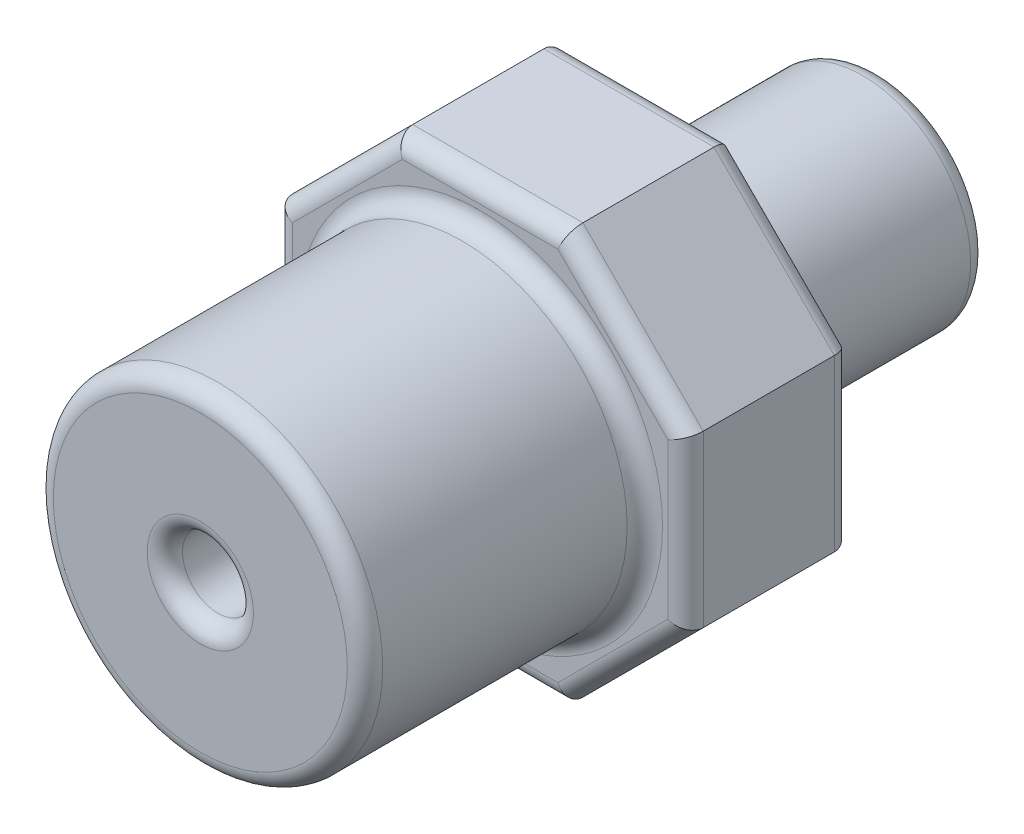
from build123d import *

# Parameters (mm, degrees)
SKETCH1_R           = 3.05
SKETCH1_R_2         = 1
BOSS_EXTRUDE1_DEPTH = 6.6
SKETCH2_R           = 1
BOSS_EXTRUDE2_DEPTH = 4.7
SKETCH3_R           = 4.65
SKETCH3_R_2         = 1
BOSS_EXTRUDE3_DEPTH = 7.9
FILLET1_R           = 0.5


with BuildPart() as part:
    # Sketch1 → Boss-Extrude1 (new body)
    with BuildSketch(Plane.XY):
        Circle(SKETCH1_R)
        Circle(SKETCH1_R_2, mode=Mode.SUBTRACT)
    extrude(amount=BOSS_EXTRUDE1_DEPTH)

    # Sketch2 → Boss-Extrude2 (add)
    with BuildSketch(Plane.XY.offset(6.6)):
        Polygon((5.8, -2.402438662), (5.8, 2.402438662), (2.402438662, 5.8), (-2.402438662, 5.8), (-5.8, 2.402438662), (-5.8, -2.402438662), (-2.402438662, -5.8), (2.402438662, -5.8), align=None)
        Circle(SKETCH2_R, mode=Mode.SUBTRACT)
    extrude(amount=BOSS_EXTRUDE2_DEPTH)

    # Sketch3 → Boss-Extrude3 (add)
    with BuildSketch(Plane.XY.offset(11.3)):
        Circle(SKETCH3_R)
        Circle(SKETCH3_R_2, mode=Mode.SUBTRACT)
    extrude(amount=BOSS_EXTRUDE3_DEPTH)

    # Fillet1
    fillet1_edges = [part.edges().sort_by_distance(p)[0] for p in [
        (-4.101219331, 4.101219331, 11.3),
        (-5.8, 0, 11.3),
        (-4.101219331, -4.101219331, 11.3),
        (0, -5.8, 11.3),
        (4.101219331, -4.101219331, 11.3),
        (5.8, 0, 11.3),
        (4.101219331, 4.101219331, 11.3),
        (0, 5.8, 11.3),
        (-4.101219331, 4.101219331, 6.6),
        (-5.8, 0, 6.6),
        (-4.101219331, -4.101219331, 6.6),
        (0, -5.8, 6.6),
        (4.101219331, -4.101219331, 6.6),
        (5.8, 0, 6.6),
        (4.101219331, 4.101219331, 6.6),
        (0, 5.8, 6.6),
        (-3.05, 0, 0),
        (-4.65, 0, 11.3),
        (-4.65, 0, 19.2),
        (-1, 0, 19.2),
        (-3.05, 0, 6.6),
        (-1, 0, 0),
    ]]
    fillet(fillet1_edges, radius=FILLET1_R)


solid = part.part
